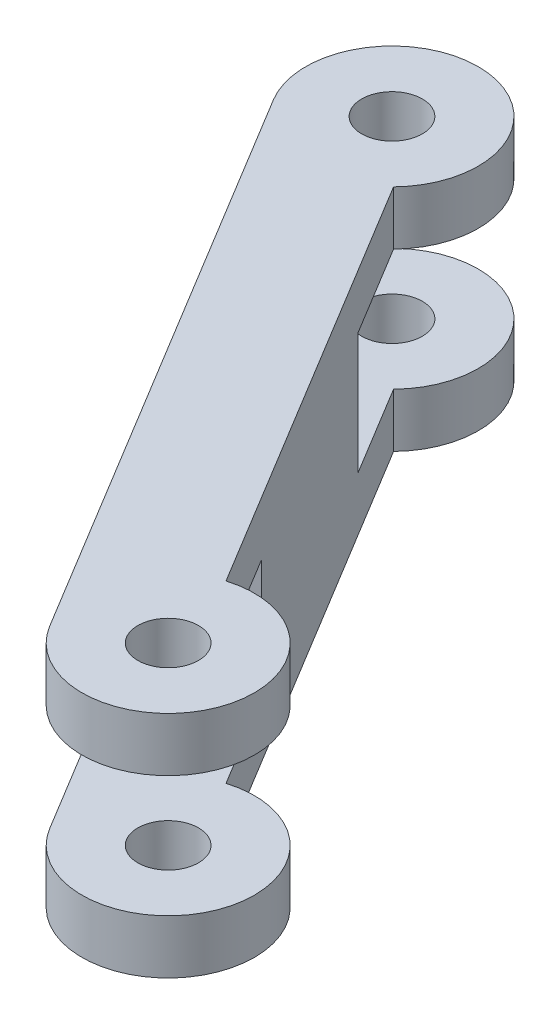
from build123d import *

# Parameters (mm, degrees)
SKETCH1_R           = 1.125
BOSS_EXTRUDE5_DEPTH = 8.5
SKETCH3_W           = 15.998285444
SKETCH3_H           = 4.5
SKETCH3_W_2         = 14.781977404
CUT_EXTRUDE1_DEPTH  = 8.5


with BuildPart() as part:
    # Sketch1 → Boss-Extrude5 (new body)
    with BuildSketch(Plane(origin=(0, 0, 0), x_dir=(1, 0, 0), z_dir=(0, 1, 0))):
        with BuildLine():
            Line((-27.093662294, 63.483418595), (-14.330111131, 42.417509095))
            ThreePointArc((-14.330111131, 42.417509095), (-8.606773323, 42.92644123), (-12.512429784, 47.140875379))
            Line((-12.512429784, 47.140875379), (-22.065450081, 62.90788712))
            ThreePointArc((-22.065450081, 62.90788712), (-23.992920625, 68.320877504), (-27.093662294, 63.483418595))
        make_face()
        with Locations(Location((-24.356818103, 65.141635672, 0), (0, 0, 270))):
            Circle(SKETCH1_R, mode=Mode.SUBTRACT)
        with Locations(Location((-11.59326694, 44.075726171, 0), (0, 0, 270))):
            Circle(SKETCH1_R, mode=Mode.SUBTRACT)
    extrude(amount=BOSS_EXTRUDE5_DEPTH)

    # Sketch3 → Cut-Extrude1 (cut)
    with BuildSketch(Plane(origin=(8.31694784, 0, -5.039126807), x_dir=(0.518192836351311, 0, 0.855263809800335), z_dir=(-0.8552638098003349, 0, 0.5181928363513109))):
        with Locations((-69.33395488, 4.25)):
            Rectangle(SKETCH3_W, SKETCH3_H)
        with Locations((-43.312932661, 4.25)):
            Rectangle(SKETCH3_W_2, SKETCH3_H)
    extrude(amount=-CUT_EXTRUDE1_DEPTH, mode=Mode.SUBTRACT)


solid = part.part
